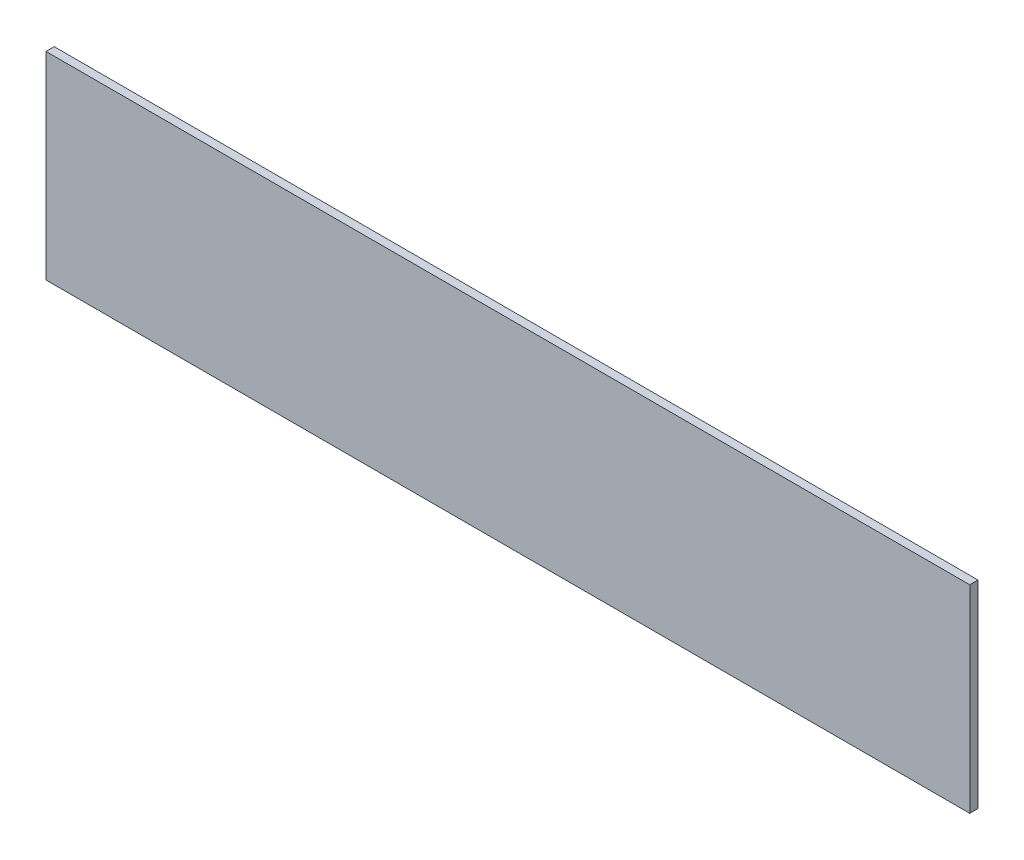
from build123d import *

# Parameters (mm, degrees)
SKETCH1_W           = 177.8
SKETCH1_H           = 38.1
BOSS_EXTRUDE1_DEPTH = 1.5875


with BuildPart() as part:
    # Sketch1 → Boss-Extrude1 (new body)
    with BuildSketch(Plane.XY):
        with Locations((88.9, 19.05)):
            Rectangle(SKETCH1_W, SKETCH1_H)
    extrude(amount=BOSS_EXTRUDE1_DEPTH)


solid = part.part
